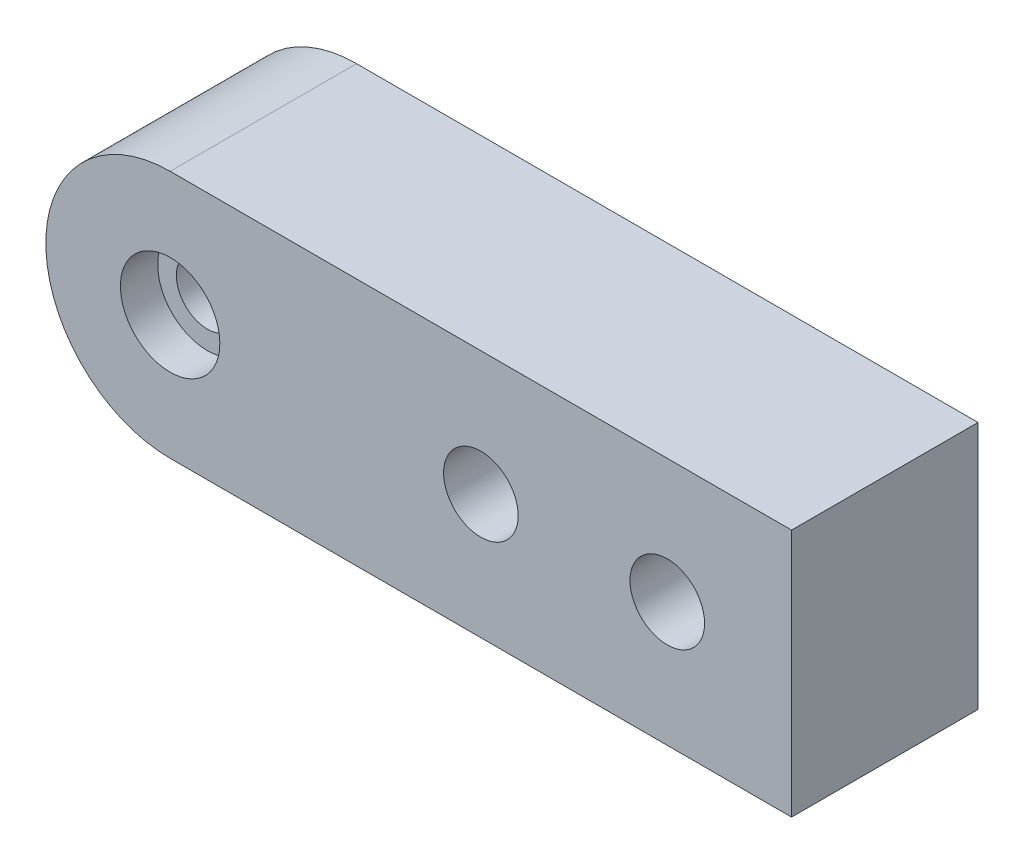
from build123d import *

# Parameters (mm, degrees)
SKETCH_1_R          = 3
EXTRUDE_1_DEPTH     = 15
SKETCH_2_R          = 4
CUT_EXTRUDE_1_DEPTH = 3
SKETCH_3_R          = 2.5
CUT_EXTRUDE_2_DEPTH = 15
SKETCH_4_R          = 5
CUT_EXTRUDE_3_DEPTH = 6


with BuildPart() as part:
    # 草图1 → 凸台-拉伸1 (new body)
    with BuildSketch(Plane.XY):
        with BuildLine():
            Line((-50, 0), (0, 0))
            Line((0, 0), (0, -20))
            Line((0, -20), (-50, -20))
            ThreePointArc((-50, -20), (-60, -10), (-50, 0))
        make_face()
        with Locations((-25, -10)):
            Circle(SKETCH_1_R, mode=Mode.SUBTRACT)
        with Locations((-10, -10)):
            Circle(SKETCH_1_R, mode=Mode.SUBTRACT)
    extrude(amount=EXTRUDE_1_DEPTH)

    # 草图2 → 切除-拉伸1 (cut)
    with BuildSketch(Plane.XY.offset(15)):
        with Locations((-50, -10)):
            Circle(SKETCH_2_R)
    extrude(amount=-CUT_EXTRUDE_1_DEPTH, mode=Mode.SUBTRACT)

    # 草图3 → 切除-拉伸2 (cut)
    with BuildSketch(Plane.XY.offset(12)):
        with Locations((-50, -10)):
            Circle(SKETCH_3_R)
    extrude(amount=-CUT_EXTRUDE_2_DEPTH, mode=Mode.SUBTRACT)

    # 草图4 → 切除-拉伸3 (cut)
    with BuildSketch(Plane(origin=(0, 0, 0), x_dir=(-1, 0, 0), z_dir=(0, 0, -1))):
        with Locations((10, -10)):
            Circle(SKETCH_4_R)
        with Locations((25, -10)):
            Circle(SKETCH_4_R)
    extrude(amount=-CUT_EXTRUDE_3_DEPTH, mode=Mode.SUBTRACT)


solid = part.part
